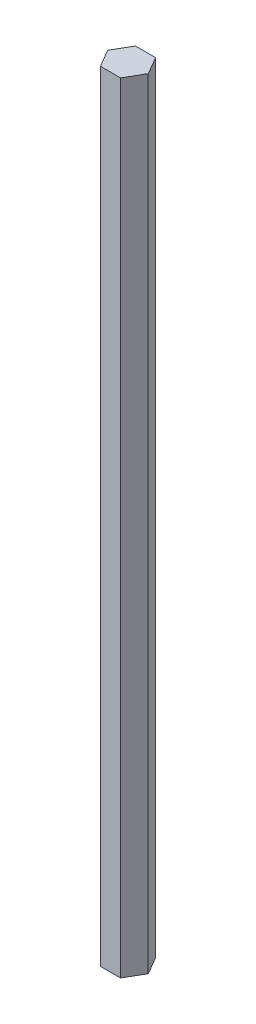
from build123d import *

# Parameters (mm, degrees)
BOSS_EXTRUDE1_DEPTH      = 5.452034
BOSS_EXTRUDE1_DEPTH_BACK = 61.3


with BuildPart() as part:
    # Sketch1 → Boss-Extrude1 (new, two sides: drawn at the far end of the back side and taken through both)
    with BuildSketch(Plane(origin=(0, 0, 0), x_dir=(1, 0, 0), z_dir=(0, 1, 0)).offset(-BOSS_EXTRUDE1_DEPTH_BACK)):
        Polygon((1.732050808, 0), (0.866025404, 1.5), (-0.866025404, 1.5), (-1.732050808, 0), (-0.866025404, -1.5), (0.866025404, -1.5), align=None)
    extrude(amount=BOSS_EXTRUDE1_DEPTH + BOSS_EXTRUDE1_DEPTH_BACK)


solid = part.part
